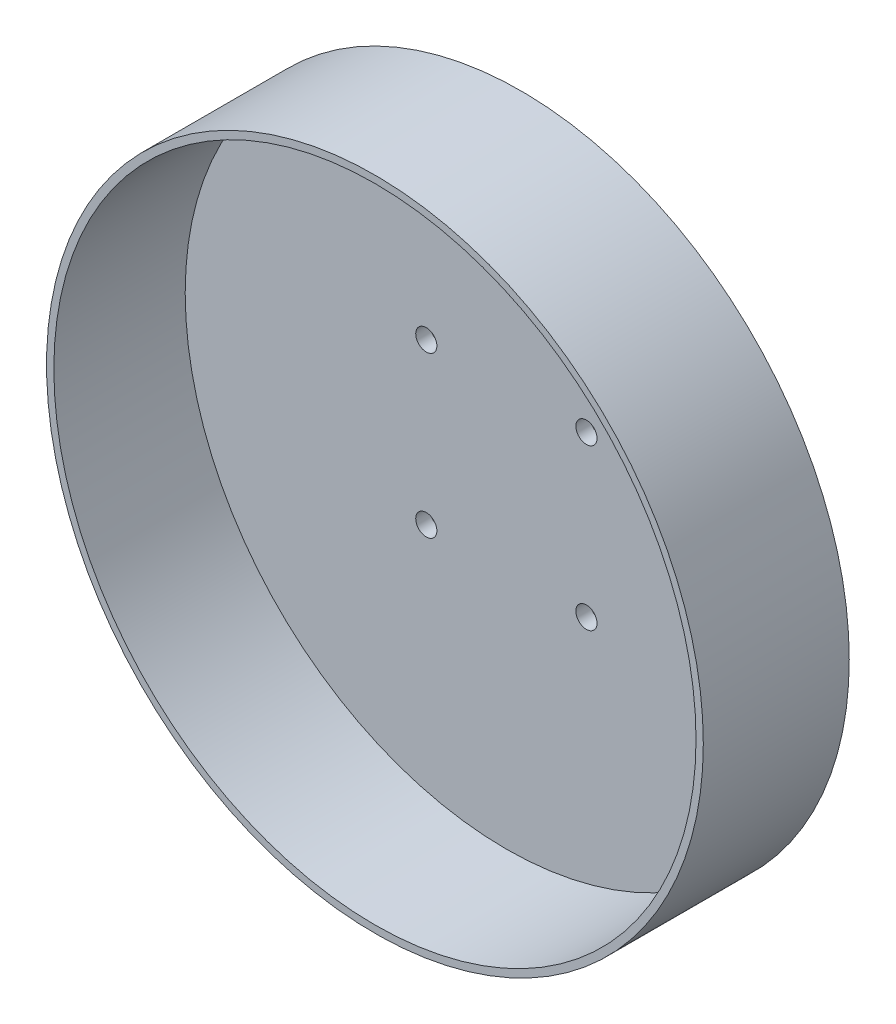
from build123d import *

# Parameters (mm, degrees)
SKETCH1_R               = 45
SKETCH1_R_2             = 44
BOSS_EXTRUDE1_DEPTH     = 18
BOSS_EXTRUDE2_START     = -2
SKETCH1_2_R             = 45
SKETCH1_2_R_2           = 44
BOSS_EXTRUDE2_DEPTH     = 2
M3_5X0_6_TAPPED_HOLE1_D = 2.9
CIRPATTERN1_COUNT       = 4


with BuildPart() as part:
    # Sketch1 → Boss-Extrude1 (new body)
    with BuildSketch(Plane.XY):
        Circle(SKETCH1_R)
        Circle(SKETCH1_R_2, mode=Mode.SUBTRACT)
    extrude(amount=BOSS_EXTRUDE1_DEPTH)

    # Sketch1<2> → Boss-Extrude2 (add)
    # profile 1 of 2: a face of its own
    with BuildSketch(Plane.XY.offset(BOSS_EXTRUDE2_START)):
        Circle(SKETCH1_2_R)
        Circle(SKETCH1_2_R_2, mode=Mode.SUBTRACT)
    # profile 2 of 2: a face of its own
    with BuildSketch(Plane.XY.offset(BOSS_EXTRUDE2_START)):
        Circle(SKETCH1_2_R_2)
    extrude(amount=BOSS_EXTRUDE2_DEPTH)

    # M3.5x0.6 Tapped Hole1 (through all)
    with Locations(Plane(origin=(0, 0, -2), x_dir=(-1, 0, 0), z_dir=(0, 0, -1))):
        with Locations((10.960155108, 10.960155108)):
            m3_5x0_6_tapped_hole1 = Hole(M3_5X0_6_TAPPED_HOLE1_D / 2)

    # CirPattern1: M3.5x0.6 Tapped Hole1 ×4 about axis
    cirpattern1_axis = Axis((0.011391445, -0.011391445, 0), (0, 0, 1))
    for i in range(1, CIRPATTERN1_COUNT):
        add(m3_5x0_6_tapped_hole1.rotate(cirpattern1_axis, i * 360 / CIRPATTERN1_COUNT), mode=Mode.SUBTRACT)


solid = part.part
